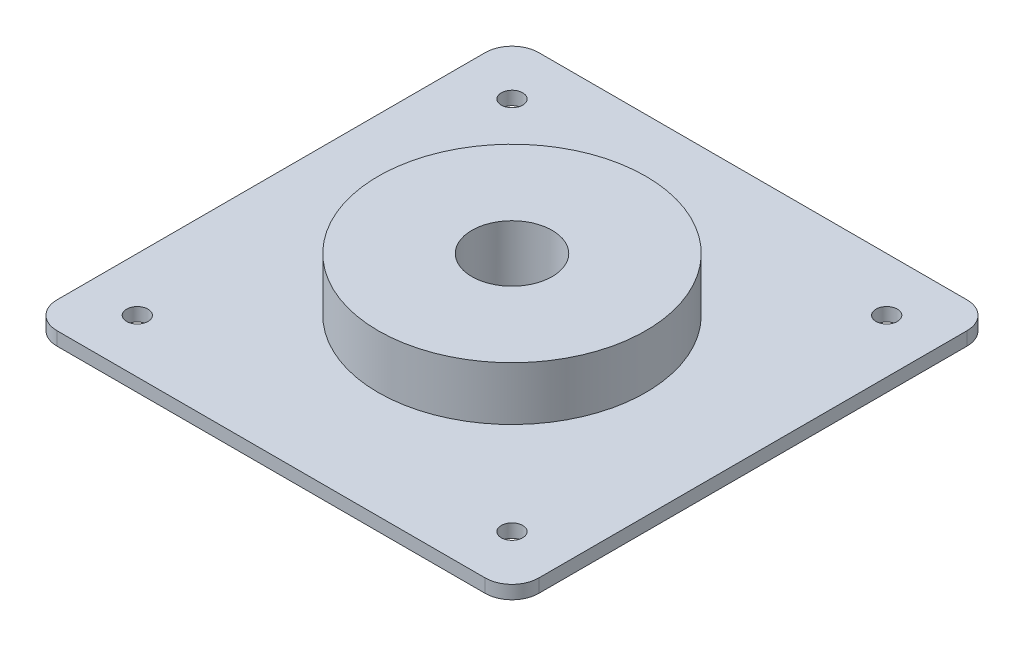
from build123d import *

# Parameters (mm, degrees)
BOSS_EXTRUDE1_DEPTH  = 5
SKETCH2_R            = 4
CUT_EXTRUDE1_DEPTH   = 10
LPATTERN1_COUNT      = 2
LPATTERN1_PITCH      = 140
LPATTERN1_COUNT_DIR2 = 2
LPATTERN1_PITCH_DIR2 = 140
SKETCH3_R            = 50
BOSS_EXTRUDE2_DEPTH  = 20
SKETCH5_R            = 15
CUT_EXTRUDE3_DEPTH   = 50


with BuildPart() as part:
    # Sketch1 → Boss-Extrude1 (new body)
    with BuildSketch(Plane(origin=(0, 0, 0), x_dir=(1, 0, 0), z_dir=(0, 1, 0))):
        with BuildLine():
            Line((10, 0), (170, 0))
            ThreePointArc((170, 0), (177.071067812, 2.928932188), (180, 10))
            Line((180, 10), (180, 170))
            ThreePointArc((180, 170), (177.071067812, 177.071067812), (170, 180))
            Line((170, 180), (10, 180))
            ThreePointArc((10, 180), (2.928932188, 177.071067812), (0, 170))
            Line((0, 170), (0, 10))
            ThreePointArc((0, 10), (2.928932188, 2.928932188), (10, 0))
        make_face()
    extrude(amount=BOSS_EXTRUDE1_DEPTH)

    # Sketch2 → Cut-Extrude1 (cut)
    with BuildSketch(Plane(origin=(0, 5, 0), x_dir=(1, 0, 0), z_dir=(0, 1, 0))):
        with Locations(Location((20, 20, 0), (0, 0, 270))):
            Circle(SKETCH2_R)
    cut_extrude1 = extrude(amount=-CUT_EXTRUDE1_DEPTH, mode=Mode.SUBTRACT)

    # LPattern1: Cut-Extrude1 2 × 2
    with Locations(*[(i * LPATTERN1_PITCH, 0, -j * LPATTERN1_PITCH_DIR2) for i in range(LPATTERN1_COUNT) for j in range(LPATTERN1_COUNT_DIR2) if (i, j) != (0, 0)]):
        add(cut_extrude1, mode=Mode.SUBTRACT)

    # Sketch3 → Boss-Extrude2 (add)
    with BuildSketch(Plane(origin=(0, 5, 0), x_dir=(1, 0, 0), z_dir=(0, 1, 0))):
        with Locations(Location((90, 90, 0), (0, 0, 270))):
            Circle(SKETCH3_R)
    extrude(amount=BOSS_EXTRUDE2_DEPTH)

    # Sketch5 → Cut-Extrude3 (cut)
    with BuildSketch(Plane(origin=(0, 25, 0), x_dir=(1, 0, 0), z_dir=(0, 1, 0))):
        with Locations(Location((90, 90, 0), (0, 0, 270))):
            Circle(SKETCH5_R)
    extrude(amount=-CUT_EXTRUDE3_DEPTH, mode=Mode.SUBTRACT)


solid = part.part
